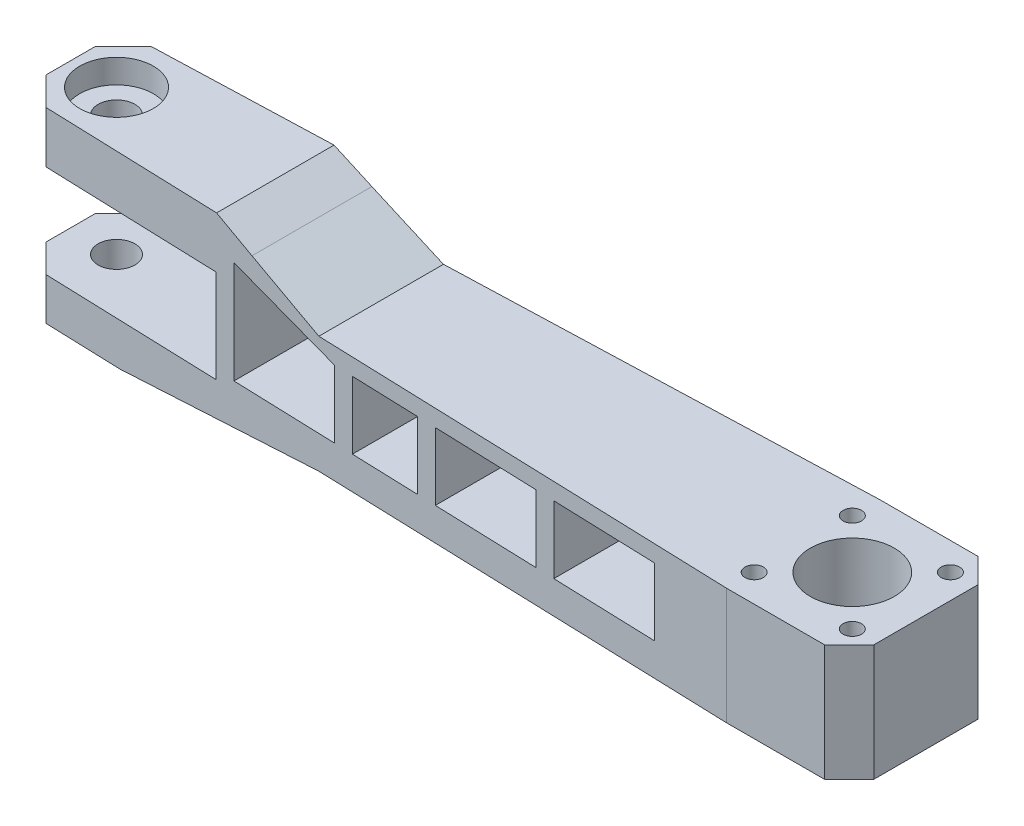
from build123d import *

# Parameters (mm, degrees)
SKETCH1_R           = 1.5
SKETCH1_R_2         = 3
SKETCH1_R_3         = 6.85
BOSS_EXTRUDE1_DEPTH = 30.5
CUT_EXTRUDE1_START  = 30.5
SKETCH1_3_R         = 6
CUT_EXTRUDE1_DEPTH  = 3.9
SKETCH1_4_R         = 7.8
CUT_EXTRUDE2_DEPTH  = 0.75
CUT_EXTRUDE3_START  = 30.5
SKETCH1_5_R         = 7.8
CUT_EXTRUDE3_DEPTH  = 1.5
SKETCH3_W           = 33.329175537
SKETCH3_H           = 15.2
CUT_EXTRUDE4_DEPTH  = 25
SKETCH4_W           = 11
SKETCH4_H           = 11
SKETCH4_W_2         = 17
CUT_EXTRUDE5_DEPTH  = 25
CUT_EXTRUDE6_START  = 20
SKETCH4_3_W         = 17
SKETCH4_3_H         = 11
CUT_EXTRUDE6_DEPTH  = 30


with BuildPart() as part:
    # Sketch1 → Boss-Extrude1 (new body)
    with BuildSketch(Plane(origin=(0, 0, 0), x_dir=(1, 0, 0), z_dir=(0, 1, 0))):
        Polygon((78.313978899, -8.5), (78.313978899, 8.5), (74.311754517, 12.502224382), (58.311754517, 12.502224382), (-56.589827024, 8.596194078), (-61.186021101, 4), (-61.186021101, -4), (-56.589827024, -8.596194078), (58.311754517, -12.502224382), (74.311754517, -12.502224382), align=None)
        with Locations((58.313978899, -8)):
            Circle(SKETCH1_R, mode=Mode.SUBTRACT)
        with Locations((74.313978899, -8)):
            Circle(SKETCH1_R, mode=Mode.SUBTRACT)
        with Locations((58.313978899, 8)):
            Circle(SKETCH1_R, mode=Mode.SUBTRACT)
        with Locations((74.313978899, 8)):
            Circle(SKETCH1_R, mode=Mode.SUBTRACT)
        with Locations((-53.686021101, 0)):
            Circle(SKETCH1_R_2, mode=Mode.SUBTRACT)
        with Locations((66.313978899, 0)):
            Circle(SKETCH1_R_3, mode=Mode.SUBTRACT)
    extrude(amount=BOSS_EXTRUDE1_DEPTH)

    # Sketch1<3> → Cut-Extrude1 (cut)
    with BuildSketch(Plane(origin=(0, 0, 0), x_dir=(1, 0, 0), z_dir=(0, 1, 0)).offset(CUT_EXTRUDE1_START)):
        with Locations((-53.686021101, 0)):
            Circle(SKETCH1_3_R)
    extrude(amount=-CUT_EXTRUDE1_DEPTH, mode=Mode.SUBTRACT)

    # Sketch1<4> → Cut-Extrude2 (cut, symmetric)
    with BuildSketch(Plane(origin=(0, 0, 0), x_dir=(1, 0, 0), z_dir=(0, 1, 0))):
        with Locations((66.313978899, 0)):
            Circle(SKETCH1_4_R)
    extrude(amount=CUT_EXTRUDE2_DEPTH, both=True, mode=Mode.SUBTRACT)

    # Sketch1<5> → Cut-Extrude3 (cut)
    with BuildSketch(Plane(origin=(0, 0, 0), x_dir=(1, 0, 0), z_dir=(0, 1, 0)).offset(CUT_EXTRUDE3_START)):
        with Locations((66.313978899, 0)):
            Circle(SKETCH1_5_R)
    extrude(amount=-CUT_EXTRUDE3_DEPTH, mode=Mode.SUBTRACT)

    # Sketch3 → Cut-Extrude4 (cut, symmetric)
    with BuildSketch(Plane.XY):
        with Locations((-44.521433333, 14.5)):
            Rectangle(SKETCH3_W, SKETCH3_H)
        Polygon((78.313978899, 0), (78.313978899, 3), (-10.526021101, 2.935632814), (-44.080457712, 0), (9.374237964, -19.733731398), align=None)
        Polygon((-10.526021101, 22), (78.313978899, 22), (78.313978899, 30.5), (39.447370773, 56.936233567), (-27.786021101, 30.5), (-21.817807348, 27.528259132), align=None)
    extrude(amount=CUT_EXTRUDE4_DEPTH, both=True, mode=Mode.SUBTRACT)

    # Sketch4 → Cut-Extrude5 (cut, symmetric)
    with BuildSketch(Plane.XY):
        Polygon((-24.856845564, 24.991492085), (-24.856845564, 8.276006159), (-7.856845564, 8.276006159), (-7.856845564, 19.276006159), align=None)
        with Locations((0.643154436, 13.776006159)):
            Rectangle(SKETCH4_W, SKETCH4_H)
        with Locations((17.643154436, 13.776006159)):
            Rectangle(SKETCH4_W_2, SKETCH4_H)
    extrude(amount=CUT_EXTRUDE5_DEPTH, both=True, mode=Mode.SUBTRACT)

    # Sketch4<3> → Cut-Extrude6 (cut)
    with BuildSketch(Plane.XY.offset(CUT_EXTRUDE6_START)):
        with Locations((37.643154436, 13.776006159)):
            Rectangle(SKETCH4_3_W, SKETCH4_3_H)
    extrude(amount=-CUT_EXTRUDE6_DEPTH, mode=Mode.SUBTRACT)


solid = part.part
